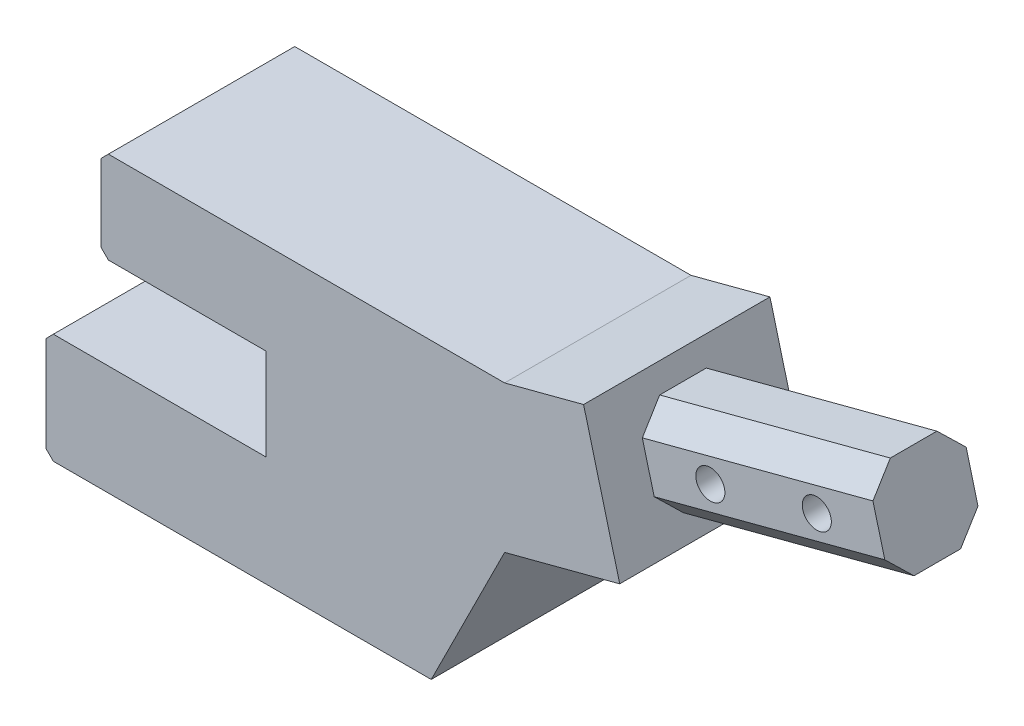
from build123d import *

# Parameters (mm, degrees)
SALIENTE_EXTRUIR1_DEPTH = 25.4
SALIENTE_EXTRUIR2_DEPTH = 12.7
CROQUIS4_R              = 3.96875
CORTAR_EXTRUIR2_DEPTH   = 143.085809608
REDONDEO1_SIZE          = 6.35


with BuildPart() as part:
    # Croquis1 → Saliente-Extruir1 (new, symmetric)
    with BuildSketch(Plane.XY):
        Polygon((21.5228, 45.6639), (31.367398371, 8.254586189), (0, 0), (-20, -40), (-123, -40), (-125, -38.012905156), (-125, -12.012905156), (-123.000083272, -10), (-65.000083272, -10), (-65.000083272, 15), (-107.993526537, 15), (-110, 16.993526537), (-110, 37.993526537), (-108.006473463, 40), (0, 40), align=None)
    extrude(amount=SALIENTE_EXTRUIR1_DEPTH, both=True)

    # Croquis2 → Saliente-Extruir2 (add, symmetric)
    with BuildSketch(Plane.XY):
        Polygon((29.677177015, 14.677399874), (92.537004524, 31.219530495), (86.072848866, 55.783216937), (23.213021357, 39.241086316), align=None)
    extrude(amount=SALIENTE_EXTRUIR2_DEPTH, both=True)

    # Croquis4 → Cortar-Extruir2 (cut, through all)
    with BuildSketch(Plane.XY.offset(12.7)):
        with Locations((72.381126981, 39.047723164)):
            Circle(CROQUIS4_R)
        with Locations((43.3688989, 31.412893647)):
            Circle(CROQUIS4_R)
    extrude(amount=-CORTAR_EXTRUIR2_DEPTH, mode=Mode.SUBTRACT)

    # Redondeo1
    redondeo1_edges = [part.edges().sort_by_distance(p)[0] for p in [
        (61.107090769, 22.948465184, -12.7),
        (54.642935111, 47.512151626, -12.7),
        (61.107090769, 22.948465184, 12.7),
        (54.642935111, 47.512151626, 12.7),
    ]]
    chamfer(redondeo1_edges, length=REDONDEO1_SIZE)


solid = part.part
